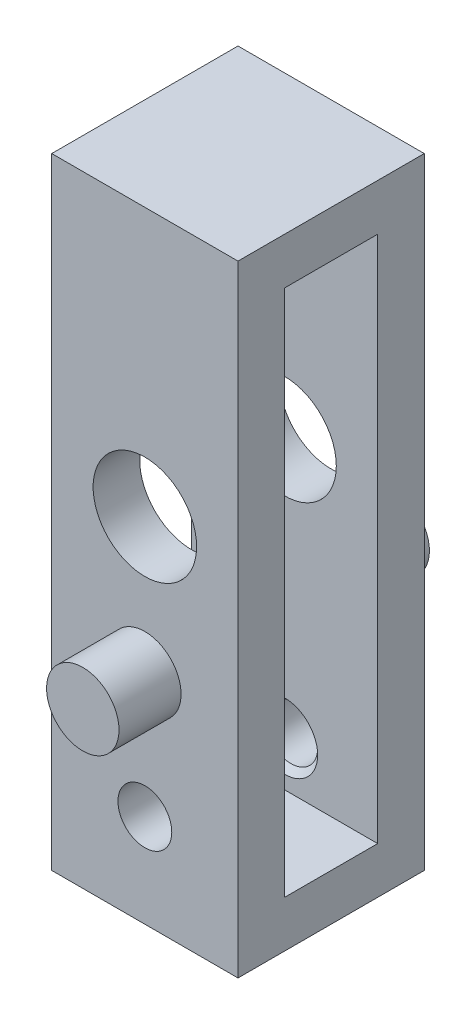
from build123d import *

# Parameters (mm, degrees)
SKETCH2_W              = 90
SKETCH2_H              = 90
BOSS_EXTRUDE1_DEPTH    = 300
SKETCH3_W              = 45
SKETCH3_H              = 255
CUT_EXTRUDE1_DEPTH     = 317.425346646
SKETCH4_R              = 25
CRANK_SHAFT_HOLE_DEPTH = 90
SKETCH5_R              = 13
CUT_EXTRUDE3_DEPTH     = 90
CHAMFER1_SIZE          = 3
SKETCH6_R              = 17.5
BOSS_EXTRUDE2_DEPTH    = 30


with BuildPart() as part:
    # Sketch2 → Boss-Extrude1 (new body)
    with BuildSketch(Plane(origin=(0, 0, 0), x_dir=(1, 0, 0), z_dir=(0, 1, 0))):
        Rectangle(SKETCH2_W, SKETCH2_H)
    extrude(amount=BOSS_EXTRUDE1_DEPTH)

    # Sketch3 → Cut-Extrude1 (cut, through all)
    with BuildSketch(Plane(origin=(45, 0, 0), x_dir=(0, 0, -1), z_dir=(1, 0, 0))):
        with Locations((0, 150)):
            Rectangle(SKETCH3_W, SKETCH3_H)
    extrude(amount=-CUT_EXTRUDE1_DEPTH, mode=Mode.SUBTRACT)

    # Sketch4 → Crank shaft hole (cut)
    with BuildSketch(Plane.XY.offset(45)):
        with Locations((0, 170.5)):
            Circle(SKETCH4_R)
    extrude(amount=-CRANK_SHAFT_HOLE_DEPTH, mode=Mode.SUBTRACT)

    # Sketch5 → Cut-Extrude3 (cut)
    with BuildSketch(Plane.XY.offset(45)):
        with Locations((0, 45)):
            Circle(SKETCH5_R)
    extrude(amount=-CUT_EXTRUDE3_DEPTH, mode=Mode.SUBTRACT)

    # Chamfer1
    chamfer1_edges = [part.edges().sort_by_distance(p)[0] for p in [
        (-13, 45, 22.5),
        (-13, 45, -22.5),
    ]]
    chamfer(chamfer1_edges, length=CHAMFER1_SIZE)

    # Sketch6 → Boss-Extrude2 (add)
    with BuildSketch(Plane.XY.offset(45)):
        with Locations(Location((0, 105, 0), (0, 0, 180))):
            Circle(SKETCH6_R)
    boss_extrude2 = extrude(amount=BOSS_EXTRUDE2_DEPTH)

    # Mirror1: Boss-Extrude2 across plane
    add(boss_extrude2.mirror(Plane.XY))


solid = part.part
